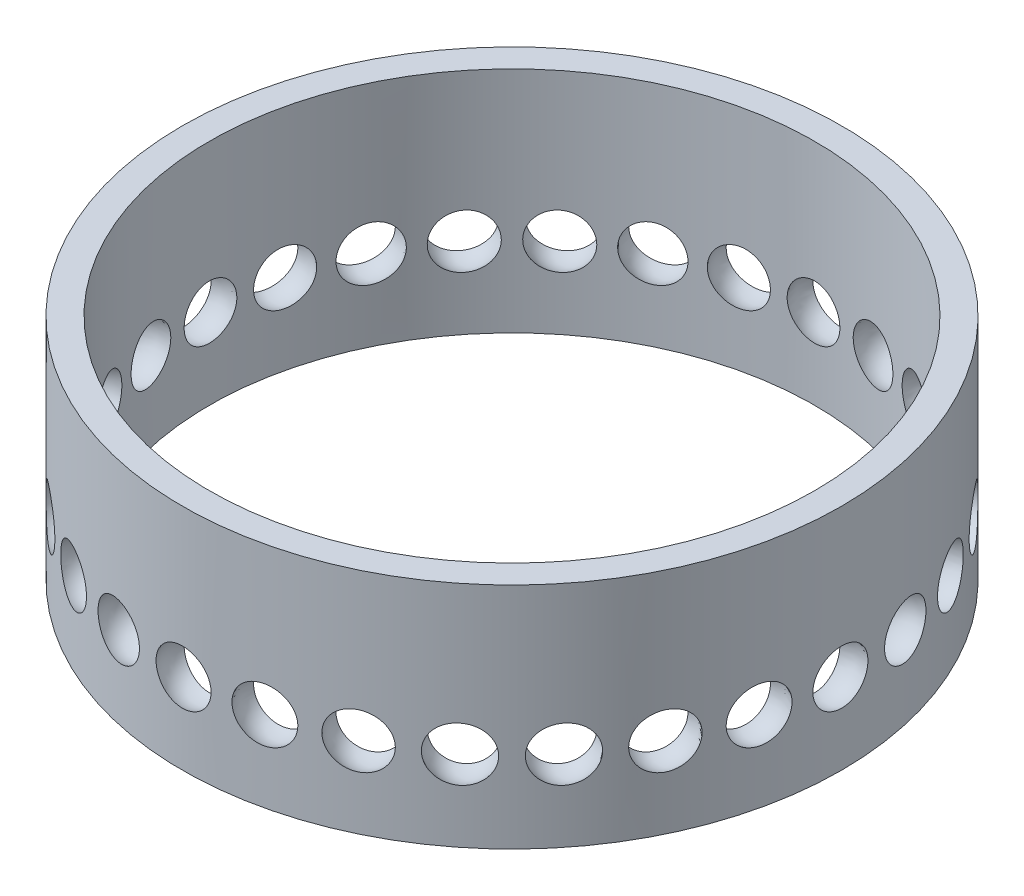
from build123d import *

# Parameters (mm, degrees)
EXTRUDE_THIN1_START = -3
SKETCH1_R           = 12.25
SKETCH1_R_2         = 11.25
EXTRUDE_THIN1_DEPTH = 8.5
CIRPATTERN1_COUNT   = 28


with BuildPart() as part:
    # Sketch1 → Extrude-Thin1 (new body)
    with BuildSketch(Plane(origin=(0, 0, 0), x_dir=(1, 0, 0), z_dir=(0, 1, 0)).offset(EXTRUDE_THIN1_START)):
        Circle(SKETCH1_R)
        Circle(SKETCH1_R_2, mode=Mode.SUBTRACT)
    extrude(amount=EXTRUDE_THIN1_DEPTH)

    # Sketch2 → Cut-Revolve1 (revolve, cut)
    with BuildSketch(Plane.XY):
        with BuildLine():
            Line((11.75, -1.12), (11.75, 1.12))
            ThreePointArc((11.75, 1.12), (12.87, 0), (11.75, -1.12))
        make_face()
    cut_revolve1 = revolve(axis=Axis((11.75, -1.12, 0), (0, 1, 0)), mode=Mode.SUBTRACT)

    # CirPattern1: Cut-Revolve1 ×28 about axis
    cirpattern1_axis = Axis((0, 0, 0), (0, 1, 0))
    for i in range(1, CIRPATTERN1_COUNT):
        add(cut_revolve1.rotate(cirpattern1_axis, i * 360 / CIRPATTERN1_COUNT), mode=Mode.SUBTRACT)


solid = part.part
